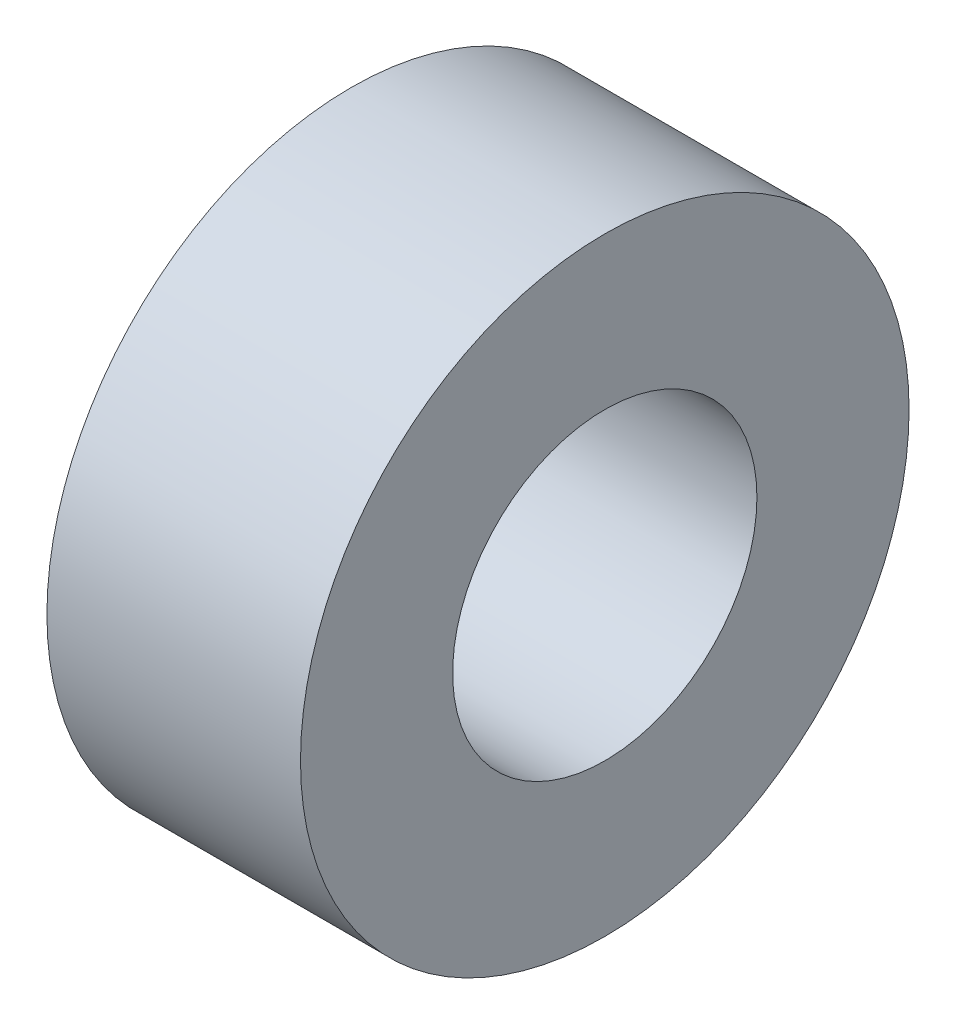
from build123d import *

# Parameters (mm, degrees)
SKETCH1_R           = 3
SKETCH1_R_2         = 1.5
BOSS_EXTRUDE1_DEPTH = 2.5


with BuildPart() as part:
    # Sketch1 → Boss-Extrude1 (new body)
    with BuildSketch(Plane(origin=(0, 0, 0), x_dir=(0, 0, -1), z_dir=(1, 0, 0))):
        Circle(SKETCH1_R)
        Circle(SKETCH1_R_2, mode=Mode.SUBTRACT)
    extrude(amount=BOSS_EXTRUDE1_DEPTH)


solid = part.part
